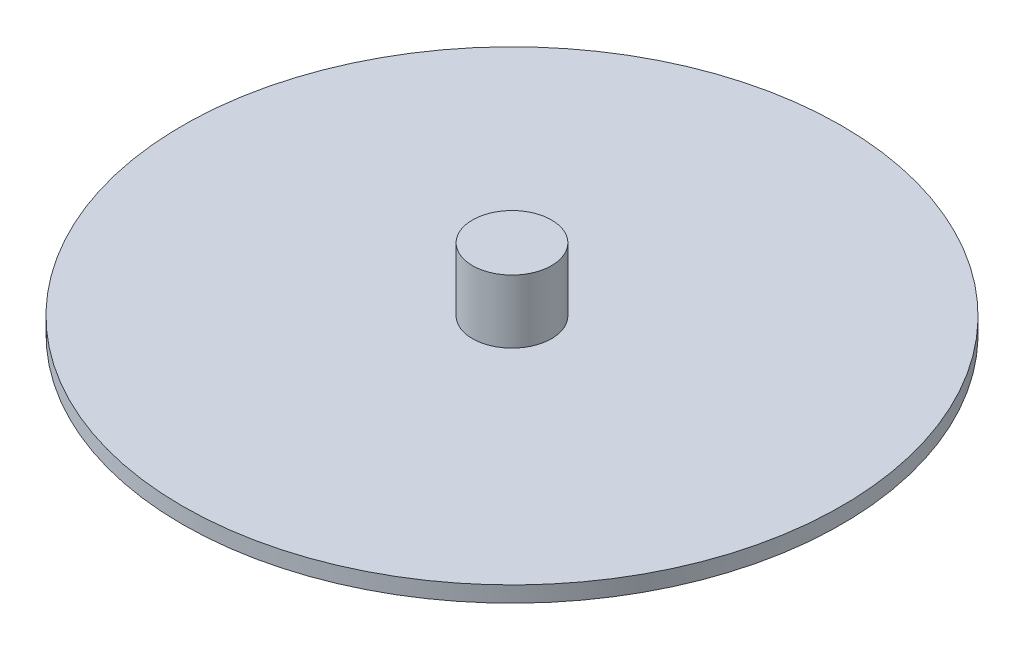
from build123d import *

# Parameters (mm, degrees)
SKETCH1_R                               = 125
SKETCH1_R_2                             = 10
BOSS_EXTRUDE1_DEPTH                     = 3
SKETCH2_R                               = 125
B_T_CH_N_DRONE_DEPTH                    = 3
SKETCH3_R                               = 15
TR_C_G_N_V_O_V_NG_BI_THAY_I_MATCH_DEPTH = 24


with BuildPart() as part:
    # Sketch1 → Boss-Extrude1 (new body)
    with BuildSketch(Plane(origin=(0, 0, 0), x_dir=(1, 0, 0), z_dir=(0, 1, 0))):
        with Locations(Location((0, 0, 0), (0, 0, 270))):
            Circle(SKETCH1_R)
        with Locations(Location((0, 100, 0), (0, 0, 270))):
            Circle(SKETCH1_R_2, mode=Mode.SUBTRACT)
        with Locations(Location((100, 0, 0), (0, 0, 270))):
            Circle(SKETCH1_R_2, mode=Mode.SUBTRACT)
        with Locations(Location((0, -100, 0), (0, 0, 270))):
            Circle(SKETCH1_R_2, mode=Mode.SUBTRACT)
        with Locations(Location((-100, 0, 0), (0, 0, 270))):
            Circle(SKETCH1_R_2, mode=Mode.SUBTRACT)
    extrude(amount=BOSS_EXTRUDE1_DEPTH)

    # Sketch2 → bắt chân drone (add)
    with BuildSketch(Plane(origin=(0, 3, 0), x_dir=(1, 0, 0), z_dir=(0, 1, 0))):
        with Locations(Location((0, 0, 0), (0, 0, 270))):
            Circle(SKETCH2_R)
    extrude(amount=B_T_CH_N_DRONE_DEPTH)

    # Sketch3 → Trục gắn vào vòng bi (Thay đổi để match) (add)
    with BuildSketch(Plane(origin=(0, 6, 0), x_dir=(1, 0, 0), z_dir=(0, 1, 0))):
        with Locations(Location((0, 0, 0), (0, 0, 270))):
            Circle(SKETCH3_R)
    extrude(amount=TR_C_G_N_V_O_V_NG_BI_THAY_I_MATCH_DEPTH)


solid = part.part
